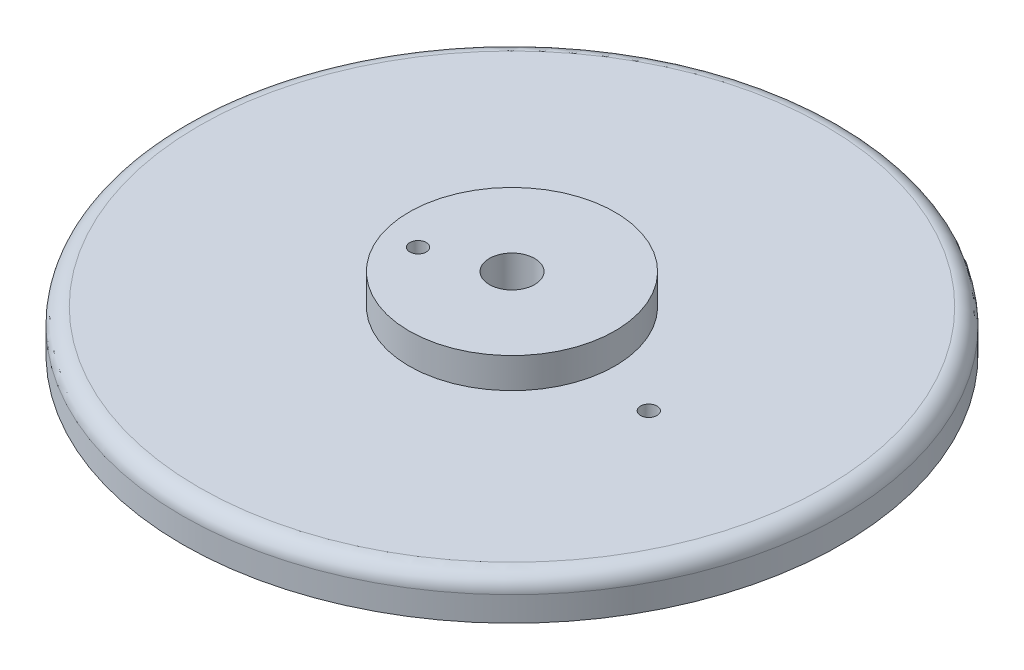
from build123d import *

# Parameters (mm, degrees)
SKETCH2_R           = 40
SKETCH2_R_2         = 2.75
BOSS_EXTRUDE1_DEPTH = 5
FILLET1_R           = 2
SKETCH3_R           = 12.5
SKETCH3_R_2         = 2.75
BOSS_EXTRUDE2_DEPTH = 3.69
SKETCH4_R           = 1
CUT_EXTRUDE1_DEPTH  = 58.23212479


with BuildPart() as part:
    # Sketch2 → Boss-Extrude1 (new body)
    with BuildSketch(Plane(origin=(0, 0, 0), x_dir=(1, 0, 0), z_dir=(0, 1, 0))):
        with Locations(Location((0, 0, 0), (0, 0, 270))):
            Circle(SKETCH2_R)
        with Locations(Location((0, 0, 0), (0, 0, 270))):
            Circle(SKETCH2_R_2, mode=Mode.SUBTRACT)
    extrude(amount=BOSS_EXTRUDE1_DEPTH)

    # Fillet1
    fillet1_edges = [part.edges().sort_by_distance(p)[0] for p in [
        (0, 5, -40),
    ]]
    fillet(fillet1_edges, radius=FILLET1_R)

    # Sketch3 → Boss-Extrude2 (add)
    with BuildSketch(Plane(origin=(0, 5, 0), x_dir=(1, 0, 0), z_dir=(0, 1, 0))):
        with Locations(Location((0, 0, 0), (0, 0, 270))):
            Circle(SKETCH3_R)
        with Locations(Location((0, 0, 0), (0, 0, 270))):
            Circle(SKETCH3_R_2, mode=Mode.SUBTRACT)
    extrude(amount=BOSS_EXTRUDE2_DEPTH)

    # Sketch4 → Cut-Extrude1 (cut, through all)
    with BuildSketch(Plane(origin=(0, 8.69, 0), x_dir=(1, 0, 0), z_dir=(0, 1, 0))):
        with Locations(Location((-8.25, -3.15, 0), (0, 0, 270))):
            Circle(SKETCH4_R)
        with Locations(Location((19.25, -2.65, 0), (0, 0, 270))):
            Circle(SKETCH4_R)
    extrude(amount=-CUT_EXTRUDE1_DEPTH, mode=Mode.SUBTRACT)


solid = part.part
